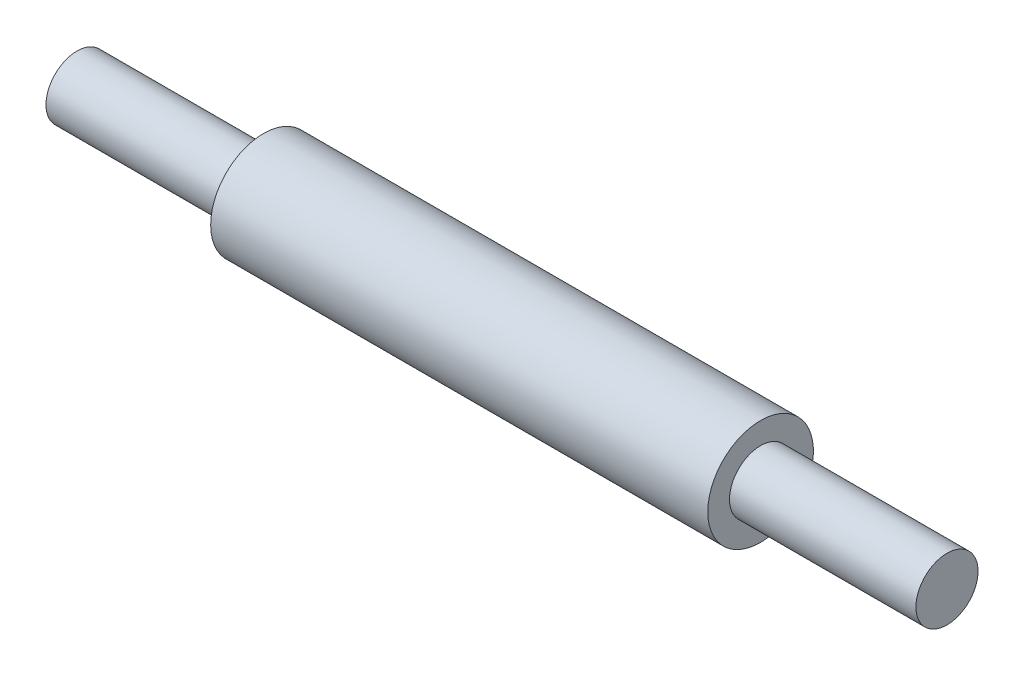
from build123d import *


with BuildPart() as part:
    # Sketch1 → Revolve1 (revolve)
    with BuildSketch(Plane(origin=(0, 0, 0), x_dir=(1, 0, 0), z_dir=(0, 1, 0)), mode=Mode.PRIVATE) as revolve1_sk:
        Polygon((40, 8.5), (-40, 8.5), (-40, 5), (-70, 5), (-70, 0), (70, 0), (70, 5), (40, 5), align=None)
    revolve(revolve1_sk.sketch.rotate(Axis((-70, 0, 0), (1, 0, 0)), 180), axis=Axis((-70, 0, 0), (1, 0, 0)))


solid = part.part
